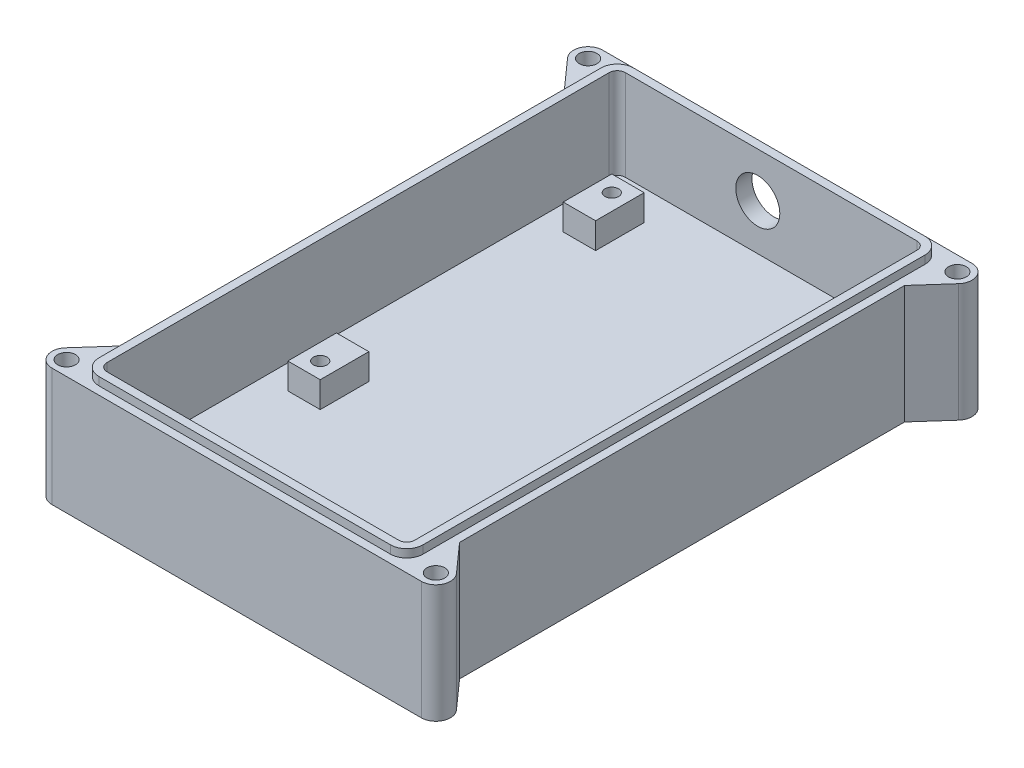
from build123d import *

# Parameters (mm, degrees)
SALIENTE_EXTRUIR2_DEPTH   = 11
SALIENTE_EXTRUIR3_DEPTH   = 25.5
SALIENTE_EXTRUIR4_DEPTH   = 2.5
SALIENTE_EXTRUIR5_DEPTH   = 36.5
SIMETR_A2_COPY_1_DEPTH    = 36.5
CROQUIS6_W                = 10
CROQUIS6_H                = 15
CROQUIS6_R                = 2.1
SALIENTE_EXTRUIR6_DEPTH   = 8
CROQUIS8_R                = 6.8
CORTAR_EXTRUIR2_DEPTH     = 8
CROQUIS9_R                = 6.5
CORTAR_EXTRUIR3_DEPTH     = 8
CORTAR_EXTRUIR4_DEPTH     = 38
CROQUIS13_R               = 2.75
CORTAR_EXTRUIR5_DEPTH     = 12.5
SIMETR_A7_COPY_1_SKETCH_R = 2.75
SIMETR_A7_COPY_1_DEPTH    = 12.5
CORTAR_EXTRUIR6_START     = -2.5
CROQUIS15_R               = 12.5
CROQUIS15_R_2             = 6.5
CORTAR_EXTRUIR6_DEPTH     = 2.5
CROQUIS16_R               = 13.413268366
SALIENTE_EXTRUIR7_DEPTH   = 5


with BuildPart() as part:
    # Croquis1 → Saliente-Extruir2 (new body)
    # profile 1 of 3: a face of its own
    with BuildSketch(Plane(origin=(0, 0, 0), x_dir=(1, 0, 0), z_dir=(0, 1, 0))):
        with BuildLine():
            Line((-45, 85), (45, 85))
            ThreePointArc((45, 85), (50.303300859, 82.803300859), (52.5, 77.5))
            Line((52.5, 77.5), (52.5, -77.5))
            ThreePointArc((52.5, -77.5), (50.303300859, -82.803300859), (45, -85))
            Line((45, -85), (-45, -85))
            ThreePointArc((-45, -85), (-50.303300859, -82.803300859), (-52.5, -77.5))
            Line((-52.5, -77.5), (-52.5, 77.5))
            ThreePointArc((-52.5, 77.5), (-50.303300859, 82.803300859), (-45, 85))
        make_face()
        with BuildLine():
            ThreePointArc((-45, 82.5), (-48.535533906, 81.035533906), (-50, 77.5))
            Line((-50, 77.5), (-50, -77.5))
            ThreePointArc((-50, -77.5), (-48.535533906, -81.035533906), (-45, -82.5))
            Line((-45, -82.5), (45, -82.5))
            ThreePointArc((45, -82.5), (48.535533906, -81.035533906), (50, -77.5))
            Line((50, -77.5), (50, 77.5))
            ThreePointArc((50, 77.5), (48.535533906, 81.035533906), (45, 82.5))
            Line((45, 82.5), (-45, 82.5))
        make_face(mode=Mode.SUBTRACT)
    # profile 2 of 3: a face of its own
    with BuildSketch(Plane(origin=(0, 0, 0), x_dir=(1, 0, 0), z_dir=(0, 1, 0))):
        with BuildLine():
            Line((-45, 82.5), (45, 82.5))
            ThreePointArc((45, 82.5), (48.535533906, 81.035533906), (50, 77.5))
            Line((50, 77.5), (50, -77.5))
            ThreePointArc((50, -77.5), (48.535533906, -81.035533906), (45, -82.5))
            Line((45, -82.5), (-45, -82.5))
            ThreePointArc((-45, -82.5), (-48.535533906, -81.035533906), (-50, -77.5))
            Line((-50, -77.5), (-50, 77.5))
            ThreePointArc((-50, 77.5), (-48.535533906, 81.035533906), (-45, 82.5))
        make_face()
        with BuildLine():
            ThreePointArc((45, -80), (46.767766953, -79.267766953), (47.5, -77.5))
            Line((47.5, -77.5), (47.5, 77.5))
            ThreePointArc((47.5, 77.5), (46.767766953, 79.267766953), (45, 80))
            Line((45, 80), (-45, 80))
            ThreePointArc((-45, 80), (-46.767766953, 79.267766953), (-47.5, 77.5))
            Line((-47.5, 77.5), (-47.5, -77.5))
            ThreePointArc((-47.5, -77.5), (-46.767766953, -79.267766953), (-45, -80))
            Line((-45, -80), (45, -80))
        make_face(mode=Mode.SUBTRACT)
    # profile 3 of 3: a face of its own
    with BuildSketch(Plane(origin=(0, 0, 0), x_dir=(1, 0, 0), z_dir=(0, 1, 0))):
        with BuildLine():
            Line((-45, -80), (45, -80))
            ThreePointArc((45, -80), (46.767766953, -79.267766953), (47.5, -77.5))
            Line((47.5, -77.5), (47.5, 77.5))
            ThreePointArc((47.5, 77.5), (46.767766953, 79.267766953), (45, 80))
            Line((45, 80), (-45, 80))
            ThreePointArc((-45, 80), (-46.767766953, 79.267766953), (-47.5, 77.5))
            Line((-47.5, 77.5), (-47.5, -77.5))
            ThreePointArc((-47.5, -77.5), (-46.767766953, -79.267766953), (-45, -80))
        make_face()
    extrude(amount=SALIENTE_EXTRUIR2_DEPTH)

    # Croquis2 → Saliente-Extruir3 (add)
    # profile 1 of 2: a face of its own
    with BuildSketch(Plane(origin=(0, 11, 0), x_dir=(1, 0, 0), z_dir=(0, 1, 0))):
        with BuildLine():
            ThreePointArc((52.5, 77.5), (50.303300859, 82.803300859), (45, 85))
            Line((45, 85), (-45, 85))
            ThreePointArc((-45, 85), (-50.303300859, 82.803300859), (-52.5, 77.5))
            Line((-52.5, 77.5), (-52.5, -77.5))
            ThreePointArc((-52.5, -77.5), (-50.303300859, -82.803300859), (-45, -85))
            Line((-45, -85), (45, -85))
            ThreePointArc((45, -85), (50.303300859, -82.803300859), (52.5, -77.5))
            Line((52.5, -77.5), (52.5, 77.5))
        make_face()
        with BuildLine():
            ThreePointArc((-45, 82.5), (-48.535533906, 81.035533906), (-50, 77.5))
            Line((-50, 77.5), (-50, -77.5))
            ThreePointArc((-50, -77.5), (-48.535533906, -81.035533906), (-45, -82.5))
            Line((-45, -82.5), (45, -82.5))
            ThreePointArc((45, -82.5), (48.535533906, -81.035533906), (50, -77.5))
            Line((50, -77.5), (50, 77.5))
            ThreePointArc((50, 77.5), (48.535533906, 81.035533906), (45, 82.5))
            Line((45, 82.5), (-45, 82.5))
        make_face(mode=Mode.SUBTRACT)
    # profile 2 of 2: a face of its own
    with BuildSketch(Plane(origin=(0, 11, 0), x_dir=(1, 0, 0), z_dir=(0, 1, 0))):
        with BuildLine():
            Line((45, 82.5), (-45, 82.5))
            ThreePointArc((-45, 82.5), (-48.535533906, 81.035533906), (-50, 77.5))
            Line((-50, 77.5), (-50, -77.5))
            ThreePointArc((-50, -77.5), (-48.535533906, -81.035533906), (-45, -82.5))
            Line((-45, -82.5), (45, -82.5))
            ThreePointArc((45, -82.5), (48.535533906, -81.035533906), (50, -77.5))
            Line((50, -77.5), (50, 77.5))
            ThreePointArc((50, 77.5), (48.535533906, 81.035533906), (45, 82.5))
        make_face()
        with BuildLine():
            ThreePointArc((-45, 80), (-46.767766953, 79.267766953), (-47.5, 77.5))
            Line((-47.5, 77.5), (-47.5, -77.5))
            ThreePointArc((-47.5, -77.5), (-46.767766953, -79.267766953), (-45, -80))
            Line((-45, -80), (45, -80))
            ThreePointArc((45, -80), (46.767766953, -79.267766953), (47.5, -77.5))
            Line((47.5, -77.5), (47.5, 77.5))
            ThreePointArc((47.5, 77.5), (46.767766953, 79.267766953), (45, 80))
            Line((45, 80), (-45, 80))
        make_face(mode=Mode.SUBTRACT)
    extrude(amount=SALIENTE_EXTRUIR3_DEPTH)

    # Croquis3 → Saliente-Extruir4 (add)
    with BuildSketch(Plane(origin=(0, 36.5, 0), x_dir=(1, 0, 0), z_dir=(0, 1, 0))):
        with BuildLine():
            Line((45, 82.5), (-45, 82.5))
            ThreePointArc((-45, 82.5), (-48.535533906, 81.035533906), (-50, 77.5))
            Line((-50, 77.5), (-50, -77.5))
            ThreePointArc((-50, -77.5), (-48.535533906, -81.035533906), (-45, -82.5))
            Line((-45, -82.5), (45, -82.5))
            ThreePointArc((45, -82.5), (48.535533906, -81.035533906), (50, -77.5))
            Line((50, -77.5), (50, 77.5))
            ThreePointArc((50, 77.5), (48.535533906, 81.035533906), (45, 82.5))
        make_face()
        with BuildLine():
            Line((-47.5, -77.5), (-47.5, 77.5))
            ThreePointArc((-47.5, 77.5), (-46.767766953, 79.267766953), (-45, 80))
            Line((-45, 80), (45, 80))
            ThreePointArc((45, 80), (46.767766953, 79.267766953), (47.5, 77.5))
            Line((47.5, 77.5), (47.5, -77.5))
            ThreePointArc((47.5, -77.5), (46.767766953, -79.267766953), (45, -80))
            Line((45, -80), (-45, -80))
            ThreePointArc((-45, -80), (-46.767766953, -79.267766953), (-47.5, -77.5))
        make_face(mode=Mode.SUBTRACT)
    extrude(amount=SALIENTE_EXTRUIR4_DEPTH)

    # Croquis4 → Saliente-Extruir5 (add)
    with BuildSketch(Plane.XZ):
        with BuildLine():
            Line((57, 85), (45, 85))
            ThreePointArc((45, 85), (50.303300859, 82.803300859), (52.5, 77.5))
            Line((52.5, 77.5), (52.5, 68.686877301))
            Line((52.5, 68.686877301), (60.359510947, 77.506058418))
            ThreePointArc((60.359510947, 77.506058418), (61.10625968, 82.340823577), (57, 85))
        make_face()
    saliente_extruir5 = extrude(amount=-SALIENTE_EXTRUIR5_DEPTH)

    # Simetría1: Saliente-Extruir5 across plane
    add(saliente_extruir5.mirror(Plane(origin=(0, 0, 0), x_dir=(0, 0, 1), z_dir=(1, 0, 0))))

    # Simetría2: Saliente-Extruir5 across plane
    add(saliente_extruir5.mirror(Plane.XY))

    # Simetría2 copy 1 sketch → Simetría2 copy 1 (add)
    with BuildSketch(Plane(origin=(0, 0, 0), x_dir=(-1, 0, 0), z_dir=(0, -1, 0))):
        with BuildLine():
            Line((57, 85), (45, 85))
            ThreePointArc((45, 85), (50.303300859, 82.803300859), (52.5, 77.5))
            Line((52.5, 77.5), (52.5, 68.686877301))
            Line((52.5, 68.686877301), (60.359510947, 77.506058418))
            ThreePointArc((60.359510947, 77.506058418), (61.10625968, 82.340823577), (57, 85))
        make_face()
    extrude(amount=-SIMETR_A2_COPY_1_DEPTH)

    # Croquis6 → Saliente-Extruir6 (add)
    # profile 1 of 4: a face of its own
    with BuildSketch(Plane(origin=(0, 11, 0), x_dir=(1, 0, 0), z_dir=(0, 1, 0))):
        with Locations((-35, 63.3)):
            Rectangle(CROQUIS6_W, CROQUIS6_H)
        with Locations(Location((-35, 65.8, 0), (0, 0, 90))):
            Circle(CROQUIS6_R, mode=Mode.SUBTRACT)
    # profile 2 of 4: a face of its own
    with BuildSketch(Plane(origin=(0, 11, 0), x_dir=(1, 0, 0), z_dir=(0, 1, 0))):
        with Locations((-35, -21.7)):
            Rectangle(CROQUIS6_W, CROQUIS6_H)
        with Locations(Location((-35, -24.2, 0), (0, 0, 270))):
            Circle(CROQUIS6_R, mode=Mode.SUBTRACT)
    # profile 3 of 4: a face of its own
    with BuildSketch(Plane(origin=(0, 11, 0), x_dir=(1, 0, 0), z_dir=(0, 1, 0))):
        with Locations((35, -21.7)):
            Rectangle(CROQUIS6_W, CROQUIS6_H)
        with Locations(Location((35, -24.2, 0), (0, 0, 90))):
            Circle(CROQUIS6_R, mode=Mode.SUBTRACT)
    # profile 4 of 4: a face of its own
    with BuildSketch(Plane(origin=(0, 11, 0), x_dir=(1, 0, 0), z_dir=(0, 1, 0))):
        with Locations((35, 63.3)):
            Rectangle(CROQUIS6_W, CROQUIS6_H)
        with Locations(Location((35, 65.8, 0), (0, 0, 270))):
            Circle(CROQUIS6_R, mode=Mode.SUBTRACT)
    extrude(amount=SALIENTE_EXTRUIR6_DEPTH)

    # Croquis8 → Cortar-Extruir2 (cut)
    with BuildSketch(Plane(origin=(0, 0, -85), x_dir=(-1, 0, 0), z_dir=(0, 0, -1))):
        with Locations((4.13, 25.14)):
            Circle(CROQUIS8_R)
    extrude(amount=-CORTAR_EXTRUIR2_DEPTH, mode=Mode.SUBTRACT)

    # Croquis9 → Cortar-Extruir3 (cut)
    with BuildSketch(Plane.ZY.offset(-47.5)):
        with Locations((0, 22)):
            Circle(CROQUIS9_R)
    extrude(amount=-CORTAR_EXTRUIR3_DEPTH, mode=Mode.SUBTRACT)

    # Croquis12 → Cortar-Extruir4 (cut)
    with BuildSketch(Plane.XY.offset(19)):
        with BuildLine():
            ThreePointArc((-17.5, 0), (-32.5, 9.552208488), (-47.5, 0))
            Line((-47.5, 0), (-42.537800124, 0))
            Line((-42.537800124, 0), (-42.500633869, 0))
            ThreePointArc((-42.500633869, 0), (-32.5, 5.20653028), (-22.499366131, 0))
            Line((-22.499366131, 0), (-17.5, 0))
        make_face()
        with BuildLine():
            Line((-42.537800124, 0), (-47.5, 0))
            ThreePointArc((-47.5, 0), (-36.085777282, -23.16172488), (-15.946514625, -7.001276887))
            ThreePointArc((-15.946514625, -7.001276887), (-16.339552007, -3.415499605), (-17.5, 0))
            Line((-17.5, 0), (-22.499366131, 0))
            ThreePointArc((-22.499366131, 0), (-20.857054375, -3.330803756), (-20.292192833, -7.001276887))
            ThreePointArc((-20.292192833, -7.001276887), (-36.170473131, -18.644222512), (-42.500633869, 0))
            Line((-42.500633869, 0), (-42.537800124, 0))
        make_face()
    cortar_extruir4 = extrude(amount=-CORTAR_EXTRUIR4_DEPTH, mode=Mode.SUBTRACT)

    # Simetría5: Cortar-Extruir4 across plane
    add(cortar_extruir4.mirror(Plane(origin=(0, 0, 0), x_dir=(0, 0, 1), z_dir=(1, 0, 0))), mode=Mode.SUBTRACT)

    # Croquis13 → Cortar-Extruir5 (cut)
    with BuildSketch(Plane(origin=(0, 36.5, 0), x_dir=(1, 0, 0), z_dir=(0, 1, 0))):
        with Locations(Location((57, 80.5, 0), (0, 0, 270))):
            Circle(CROQUIS13_R)
    cortar_extruir5 = extrude(amount=-CORTAR_EXTRUIR5_DEPTH, mode=Mode.SUBTRACT)

    # Simetría6: Cortar-Extruir5 across plane
    add(cortar_extruir5.mirror(Plane.XY), mode=Mode.SUBTRACT)

    # Simetría7: Cortar-Extruir5 across plane
    add(cortar_extruir5.mirror(Plane(origin=(0, 0, 0), x_dir=(0, 0, 1), z_dir=(1, 0, 0))), mode=Mode.SUBTRACT)

    # Simetría7 copy 1 sketch → Simetría7 copy 1 (cut)
    with BuildSketch(Plane(origin=(0, 36.5, 0), x_dir=(-1, 0, 0), z_dir=(0, 1, 0))):
        with Locations(Location((57, 80.5, 0), (0, 0, 270))):
            Circle(SIMETR_A7_COPY_1_SKETCH_R)
    extrude(amount=-SIMETR_A7_COPY_1_DEPTH, mode=Mode.SUBTRACT)

    # Croquis15 → Cortar-Extruir6 (cut)
    with BuildSketch(Plane(origin=(52.5, 0, 0), x_dir=(0, 0, -1), z_dir=(1, 0, 0)).offset(CORTAR_EXTRUIR6_START)):
        with Locations((0, 22)):
            Circle(CROQUIS15_R)
        with Locations(Location((0, 22, 0), (0, 0, 180))):
            Circle(CROQUIS15_R_2, mode=Mode.SUBTRACT)
    extrude(amount=CORTAR_EXTRUIR6_DEPTH, mode=Mode.SUBTRACT)

    # Croquis16 → Saliente-Extruir7 (add)
    with BuildSketch(Plane(origin=(52.5, 0, 0), x_dir=(0, 0, -1), z_dir=(1, 0, 0))):
        with Locations((0, 22)):
            Circle(CROQUIS16_R)
    extrude(amount=-SALIENTE_EXTRUIR7_DEPTH)


solid = part.part
